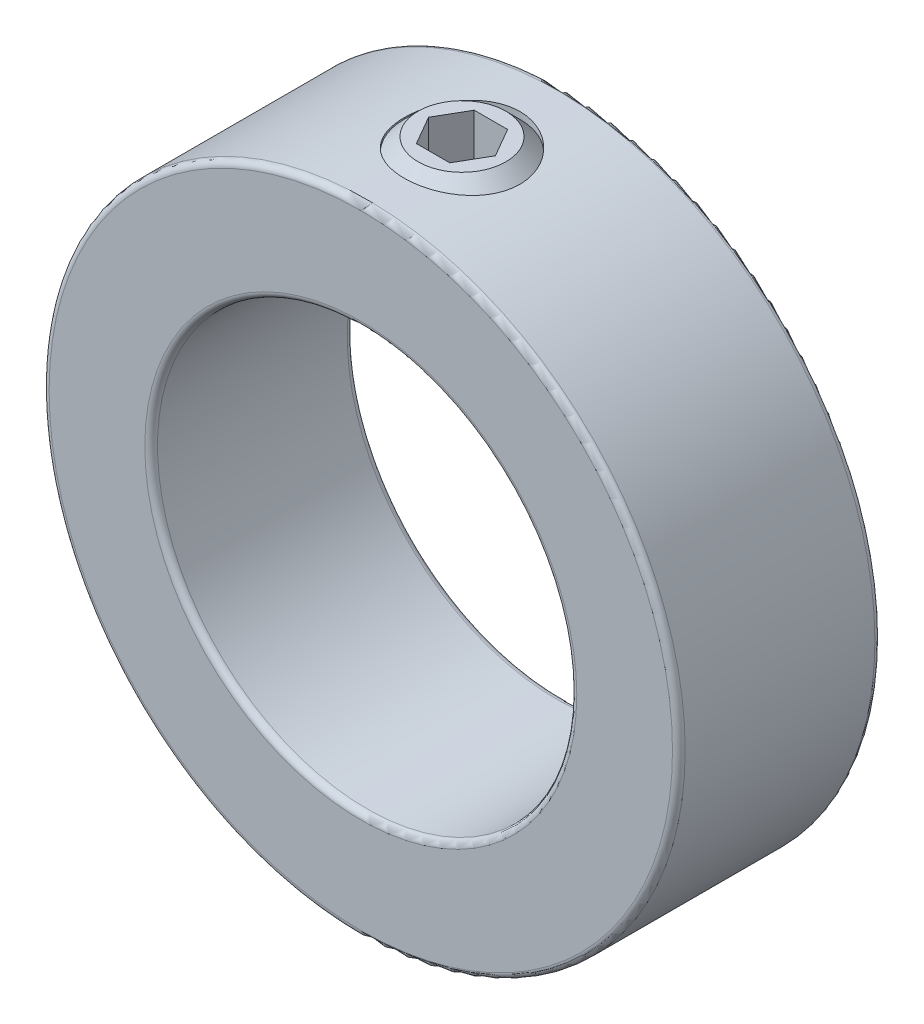
from build123d import *

# Parameters (mm, degrees)
SKETCH1_R          = 34.925
SKETCH1_R_2        = 23.01875
EXTRUDE1_DEPTH     = 11.1125
SKETCH2_R          = 6.35
CUT_EXTRUDE1_DEPTH = 85.555799808
FILLET1_R          = 0.6985
CUT_EXTRUDE2_DEPTH = 6.35


with BuildPart() as part:
    # Sketch1 → Extrude1 (new, symmetric)
    with BuildSketch(Plane.XY):
        Circle(SKETCH1_R)
        Circle(SKETCH1_R_2, mode=Mode.SUBTRACT)
    extrude(amount=EXTRUDE1_DEPTH, both=True)

    # Sketch2 → Cut-Extrude1 (cut, through all)
    with BuildSketch(Plane(origin=(41.275, 0, 0), x_dir=(0, 0, -1), z_dir=(0, -1, 0))):
        with Locations((0, -41.275)):
            Circle(SKETCH2_R)
    extrude(amount=-CUT_EXTRUDE1_DEPTH, mode=Mode.SUBTRACT)

    # Fillet1
    fillet1_edges = [part.edges().sort_by_distance(p)[0] for p in [
        (-34.925, 0, -11.1125),
        (-34.925, 0, 11.1125),
        (-23.01875, 0, -11.1125),
        (-23.01875, 0, 11.1125),
    ]]
    fillet(fillet1_edges, radius=FILLET1_R)


with BuildPart() as body_2:
    # Sketch3 → Revolve1 (revolve)
    with BuildSketch(Plane.XY):
        Polygon((-4.816385262, 23.01875), (-1.840337685, 23.01875), (0, 24.859087685), (0, 35.71875), (-4.816385262, 35.71875), (-6.35, 34.185135262), (-6.35, 24.552364738), align=None)
    revolve(axis=Axis((0, 23.01875, 0), (0, -1, 0)))

    # Sketch4 → Cut-Extrude2 (cut)
    with BuildSketch(Plane(origin=(3.3734375, 35.71875, 0), x_dir=(0, 0, -1), z_dir=(0, -1, 0))):
        Polygon((0, 0.292736709), (-3.175, -1.540350395), (-3.175, -5.206524605), (0, -7.039611709), (3.175, -5.206524605), (3.175, -1.540350395), align=None)
    extrude(amount=CUT_EXTRUDE2_DEPTH, mode=Mode.SUBTRACT)


solid = Compound([part.part, body_2.part])
